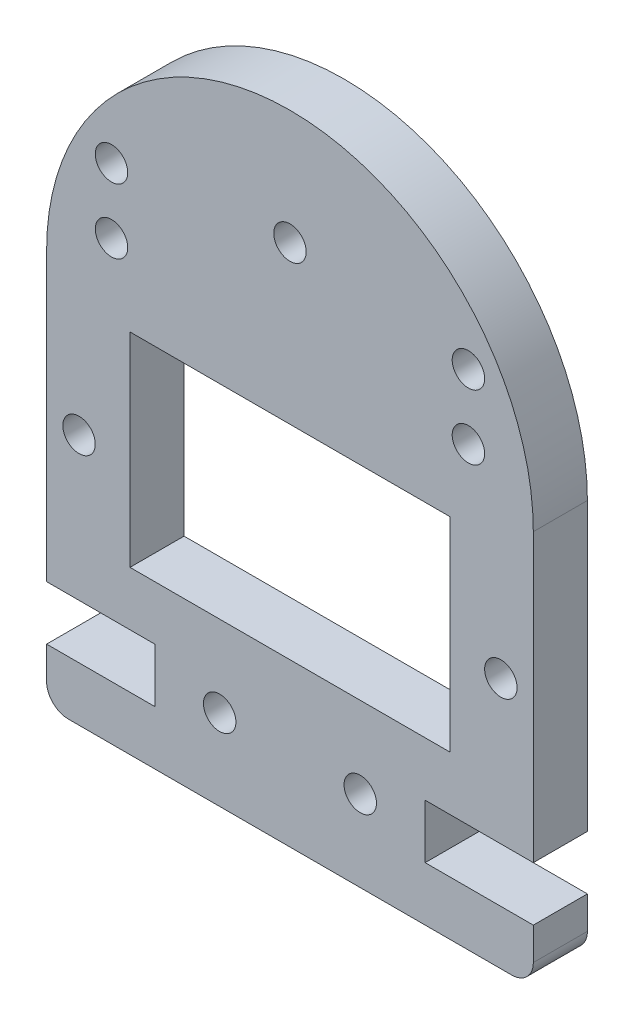
from build123d import *

# Parameters (mm, degrees)
RESSALTO_EXTRUS_O2_DEPTH = 5
ESBO_O9_W                = 29.58
ESBO_O9_H                = 18.85
CORTE_EXTRUS_O1_DEPTH    = 5
ESBO_O10_R               = 1.5
CORTE_EXTRUS_O2_DEPTH    = 5
ESBO_O12_R               = 1.5
CORTE_EXTRUS_O3_DEPTH    = 10
ESBO_O13_R               = 1.5
CORTE_EXTRUS_O4_DEPTH    = 10
ESBO_O14_R               = 1.5
CORTE_EXTRUS_O5_DEPTH    = 76


with BuildPart() as part:
    # Esboço8 → Ressalto-extrusão2 (new body)
    with BuildSketch(Plane.XY):
        with BuildLine():
            Line((-24.266341706, -3.25), (-24.266341706, 13.25))
            ThreePointArc((-24.266341706, 13.25), (-1.766341706, 35.75), (20.733658294, 13.25))
            Line((20.733658294, 13.25), (20.733658294, -3.222268622))
            Line((20.733658294, -3.222268622), (20.733658294, -3.25))
            Line((20.733658294, -3.25), (20.733658294, -13.25))
            Line((20.733658294, -13.25), (10.733658294, -13.25))
            Line((10.733658294, -13.25), (10.733658294, -18.25))
            Line((10.733658294, -18.25), (20.733658294, -18.25))
            Line((20.733658294, -18.25), (20.733658294, -21.25))
            ThreePointArc((20.733658294, -21.25), (20.147871857, -22.664213562), (18.733658294, -23.25))
            Line((18.733658294, -23.25), (-22.266341706, -23.25))
            ThreePointArc((-22.266341706, -23.25), (-23.680555268, -22.664213562), (-24.266341706, -21.25))
            Line((-24.266341706, -21.25), (-24.266341706, -18.25))
            Line((-24.266341706, -18.25), (-14.266341706, -18.25))
            Line((-14.266341706, -18.25), (-14.266341706, -13.25))
            Line((-14.266341706, -13.25), (-24.266341706, -13.25))
            Line((-24.266341706, -13.25), (-24.266341706, -3.25))
        make_face()
    extrude(amount=RESSALTO_EXTRUS_O2_DEPTH)

    # Esboço9 → Corte-extrusão1 (cut)
    with BuildSketch(Plane(origin=(0, 0, 0), x_dir=(-1, 0, 0), z_dir=(0, 0, -1))):
        with Locations((1.766341706, 1.175)):
            Rectangle(ESBO_O9_W, ESBO_O9_H)
    extrude(amount=-CORTE_EXTRUS_O1_DEPTH, mode=Mode.SUBTRACT)

    # Esboço10 → Corte-extrusão2 (cut)
    with BuildSketch(Plane(origin=(0, 0, 0), x_dir=(-1, 0, 0), z_dir=(0, 0, -1))):
        with Locations((-17.733658294, 0)):
            Circle(ESBO_O10_R)
        with Locations((21.266341706, 0)):
            Circle(ESBO_O10_R)
    extrude(amount=-CORTE_EXTRUS_O2_DEPTH, mode=Mode.SUBTRACT)

    # Esboço12 → Corte-extrusão3 (cut)
    with BuildSketch(Plane.XY.offset(5)):
        with Locations((4.733658294, -15.75)):
            Circle(ESBO_O12_R)
        with Locations((-8.266341706, -15.75)):
            Circle(ESBO_O12_R)
    extrude(amount=-CORTE_EXTRUS_O3_DEPTH, mode=Mode.SUBTRACT)

    # Esboço13 → Corte-extrusão4 (cut)
    with BuildSketch(Plane.XY.offset(5)):
        with Locations((-1.766341706, 25.15)):
            Circle(ESBO_O13_R)
    extrude(amount=-CORTE_EXTRUS_O4_DEPTH, mode=Mode.SUBTRACT)

    # Esboço14 → Corte-extrusão5 (cut)
    with BuildSketch(Plane.XY.offset(5)):
        with Locations((14.733658294, 17.25)):
            Circle(ESBO_O14_R)
        with Locations((14.733658294, 23.25)):
            Circle(ESBO_O14_R)
        with Locations((-18.266341706, 23.25)):
            Circle(ESBO_O14_R)
        with Locations((-18.266341706, 17.25)):
            Circle(ESBO_O14_R)
    extrude(amount=-CORTE_EXTRUS_O5_DEPTH, mode=Mode.SUBTRACT)


solid = part.part
